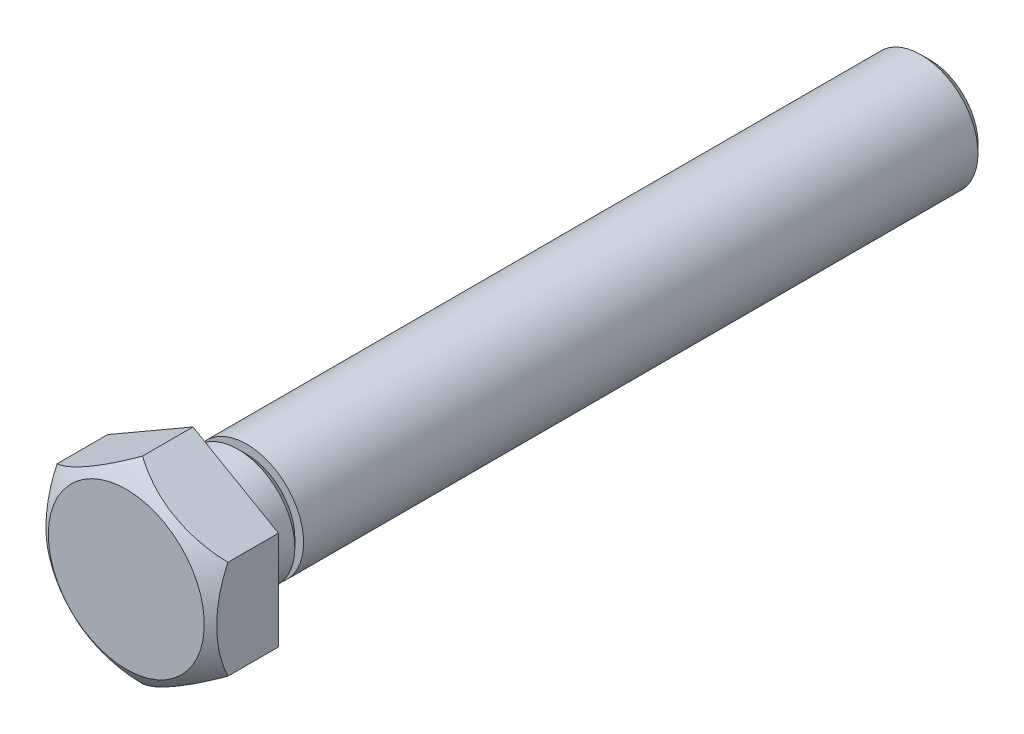
from build123d import *

# Parameters (mm, degrees)
DODANIE_WYCI_GNI_CIE1_DEPTH = 8.2
ZAOKR_GLENIE1_R             = 0.1
SFAZOWANIE1_SIZE            = 1.0825
ZAOKR_GLENIE3_R             = 0.6


with BuildPart() as part:
    # Szkic1 → Dodanie-wyciągnięcie1 (new body)
    with BuildSketch(Plane(origin=(0, 0, 0.6), x_dir=(-1, 0, 0), z_dir=(0, 0, -1))):
        Polygon((4.896e-06, 12.124341521), (-10.499990209, 6.062166521), (-10.499990209, -6.062183479), (-9.791e-06, -12.12435), (10.499990209, -6.062183479), (10.499990209, 6.062166521), align=None)
    extrude(amount=-DODANIE_WYCI_GNI_CIE1_DEPTH)

    # Szkic2 → Obrót1 (revolve)
    with BuildSketch(Plane(origin=(0, 0, 0), x_dir=(1, 0, 0), z_dir=(0, 1, 0))):
        Polygon((7, 90), (0, 90), (0, -0.6), (9.685, -0.6), (9.685, 0), (7, 0), (7, 4.9175), (5.9175, 6), (7, 6), align=None)
    revolve(axis=Axis((0, 0, -90), (0, 0, 1)))

    # Zaokrąglenie1
    zaokr_glenie1_edges = [part.edges().sort_by_distance(p)[0] for p in [
        (-9.685, 0, 0),
    ]]
    fillet(zaokr_glenie1_edges, radius=ZAOKR_GLENIE1_R)

    # Sfazowanie1
    sfazowanie1_edges = [part.edges().sort_by_distance(p)[0] for p in [
        (-7, 0, -90),
    ]]
    chamfer(sfazowanie1_edges, length=SFAZOWANIE1_SIZE)

    # Zaokrąglenie3
    zaokr_glenie3_edges = [part.edges().sort_by_distance(p)[0] for p in [
        (-7, 0, 0),
    ]]
    fillet(zaokr_glenie3_edges, radius=ZAOKR_GLENIE3_R)

    # Szkic3 → Wycięcie-obrót1 (revolve, cut)
    with BuildSketch(Plane(origin=(0, 0, 0), x_dir=(1, 0, 0), z_dir=(0, 1, 0))):
        with BuildLine():
            ThreePointArc((-17, 4.7), (-12.313708499, -6.613708499), (-1, -11.3))
            Line((-1, -11.3), (-17, -11.3))
            Line((-17, -11.3), (-17, 4.7))
        make_face()
        with BuildLine():
            ThreePointArc((-1, -11.3), (-12.313708499, -6.613708499), (-17, 4.7))
            Line((-17, 4.7), (-17, -11.3))
            Line((-17, -11.3), (-1, -11.3))
        make_face()
    revolve(axis=Axis((0, 0, -88.9175), (0, 0, 1)), mode=Mode.SUBTRACT)


solid = part.part
